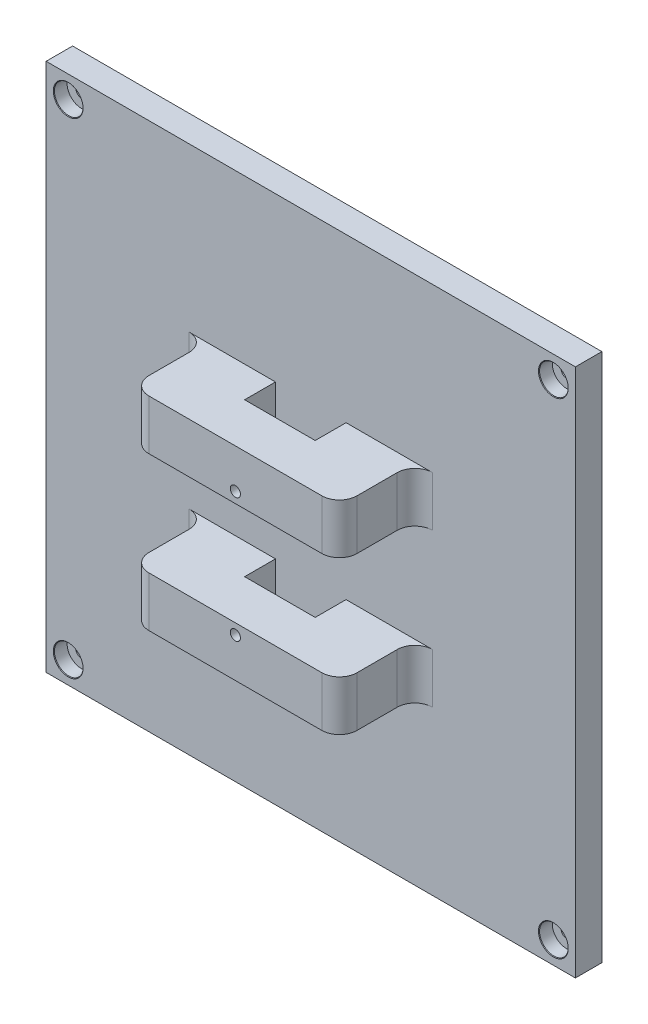
from build123d import *

# Parameters (mm, degrees)
SKETCH1_W           = 120
SKETCH1_H           = 120
BOSS_EXTRUDE1_DEPTH = 6
SKETCH3_W           = 47.19594468
SKETCH3_H           = 11.33645236
BOSS_EXTRUDE2_DEPTH = 17.1
SKETCH4_W           = 16
SKETCH4_H           = 7
CUT_EXTRUDE3_DEPTH  = 106.01743865
SKETCH6_R           = 1.15
CUT_EXTRUDE4_DEPTH  = 8
FILLET1_R           = 4


with BuildPart() as part:
    # Sketch1 → Boss-Extrude1 (new body)
    with BuildSketch(Plane(origin=(0, 0, 0), x_dir=(0, 1, 0), z_dir=(0, 0, 1))):
        Rectangle(SKETCH1_W, SKETCH1_H)
    extrude(amount=BOSS_EXTRUDE1_DEPTH)

    # Sketch7 → CBORE for M3 SBHCS1 (revolve, cut)
    with BuildSketch(Plane(origin=(-55, 55, 6), x_dir=(0, -1, 0), z_dir=(1, 0, 0))):
        Polygon((0, 0), (0, 6), (1.25, 6), (1.25, 3), (3.25, 3), (3.25, 0.125), (3.375, 0), align=None)
    cbore_for_m3_sbhcs1 = revolve(axis=Axis((-55, 55, 12.35), (0, 0, -1)), mode=Mode.SUBTRACT)

    # Mirror2: CBORE for M3 SBHCS1 across plane
    add(cbore_for_m3_sbhcs1.mirror(Plane(origin=(0, 0, 0), x_dir=(0, 0, 1), z_dir=(1, 0, 0))), mode=Mode.SUBTRACT)

    # Mirror2 at the second plane: CBORE for M3 SBHCS1 across plane
    add(cbore_for_m3_sbhcs1.mirror(Plane.ZX), mode=Mode.SUBTRACT)

    # Mirror2 at the second plane copy 1 sketc → Mirror2 at the second plane copy 1 (revolve, cut)
    with BuildSketch(Plane(origin=(55, -55, 6), x_dir=(0, 1, 0), z_dir=(-1, 0, 0))):
        Polygon((0, 0), (0, 6), (1.25, 6), (1.25, 3), (3.25, 3), (3.25, 0.125), (3.375, 0), align=None)
    revolve(axis=Axis((55, -55, 12.35), (0, 0, -1)), mode=Mode.SUBTRACT)

    # Sketch3 → Boss-Extrude2 (add)
    with BuildSketch(Plane.XY.offset(6)):
        with Locations((0, -17.36822618)):
            Rectangle(SKETCH3_W, SKETCH3_H)
        with Locations((0, 17.36822618)):
            Rectangle(SKETCH3_W, SKETCH3_H)
    extrude(amount=BOSS_EXTRUDE2_DEPTH)

    # Sketch4 → Cut-Extrude3 (cut, through all)
    with BuildSketch(Plane.XZ.offset(23.03645236)):
        with Locations((0, 9.5)):
            Rectangle(SKETCH4_W, SKETCH4_H)
    extrude(amount=-CUT_EXTRUDE3_DEPTH, mode=Mode.SUBTRACT)

    # Sketch6 → Cut-Extrude4 (cut)
    with BuildSketch(Plane.XY.offset(23.1)):
        with Locations((0, 14.1)):
            Circle(SKETCH6_R)
        with Locations(Location((0, -14.1, 0), (0, 0, 180))):
            Circle(SKETCH6_R)
    extrude(amount=-CUT_EXTRUDE4_DEPTH, mode=Mode.SUBTRACT)

    # Fillet1
    fillet1_edges = [part.edges().sort_by_distance(p)[0] for p in [
        (-23.59797234, -17.36822618, 6),
        (23.59797234, -17.36822618, 6),
        (-23.59797234, -17.36822618, 23.1),
        (23.59797234, -17.36822618, 23.1),
        (-23.59797234, 17.36822618, 6),
        (23.59797234, 17.36822618, 6),
        (-23.59797234, 17.36822618, 23.1),
        (23.59797234, 17.36822618, 23.1),
    ]]
    fillet(fillet1_edges, radius=FILLET1_R)


solid = part.part
